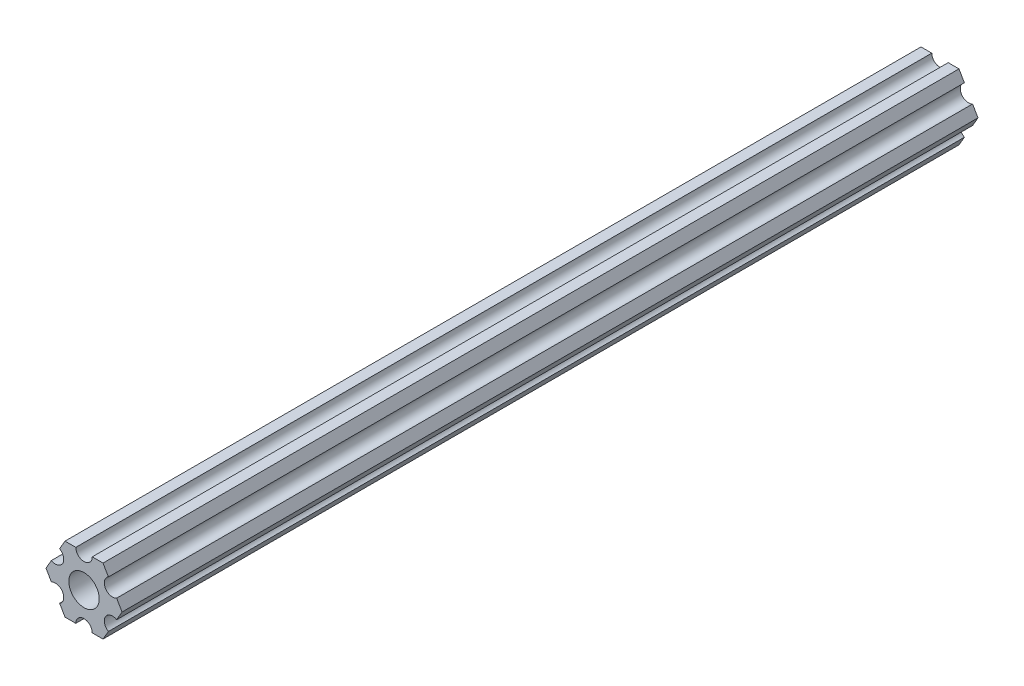
from build123d import *

# Parameters (mm, degrees)
SKETCH1_R           = 2.9337
BOSS_EXTRUDE1_DEPTH = 165.1


with BuildPart() as part:
    # Sketch1 → Boss-Extrude1 (new body)
    with BuildSketch(Plane(origin=(0, 0, 0), x_dir=(-1, 0, 0), z_dir=(0, 0, -1))):
        with BuildLine():
            Line((-4.70551159, -4.549815043), (-3.666174521, -6.349999904))
            Line((-3.666174521, -6.349999904), (-1.587500385, -6.349999904))
            ThreePointArc((-1.587500385, -6.349999904), (-3.85e-07, -4.762499904), (1.587499615, -6.349999904))
            Line((1.587499615, -6.349999904), (3.666173825, -6.349999904))
            Line((3.666173825, -6.349999904), (4.705510942, -4.54981524))
            ThreePointArc((4.705510942, -4.54981524), (4.124445629, -2.381249907), (6.293010962, -1.800184594))
            Line((6.293010962, -1.800184594), (7.332348079, 7e-08))
            Line((7.332348079, 7e-08), (6.293011217, 1.800184685))
            ThreePointArc((6.293011217, 1.800184685), (4.124445939, 2.381250203), (4.705511457, 4.549815481))
            Line((4.705511457, 4.549815481), (3.666174521, 6.350000222))
            Line((3.666174521, 6.350000222), (1.587500385, 6.350000222))
            ThreePointArc((1.587500385, 6.350000222), (3.85e-07, 4.762500222), (-1.587499615, 6.350000222))
            Line((-1.587499615, 6.350000222), (-3.666173825, 6.350000222))
            Line((-3.666173825, 6.350000222), (-4.705511038, 4.549815614))
            ThreePointArc((-4.705511038, 4.549815614), (-4.124445841, 2.38125025), (-6.293011205, 1.800185053))
            Line((-6.293011205, 1.800185053), (-7.332348419, 4.44e-07))
            Line((-7.332348419, 4.44e-07), (-6.293011423, -1.80018429))
            ThreePointArc((-6.293011423, -1.80018429), (-4.12444613, -2.38124975), (-4.70551159, -4.549815043))
        make_face()
        with Locations(Location((0, 0, 0), (0, 0, 180))):
            Circle(SKETCH1_R, mode=Mode.SUBTRACT)
    extrude(amount=BOSS_EXTRUDE1_DEPTH)


solid = part.part
